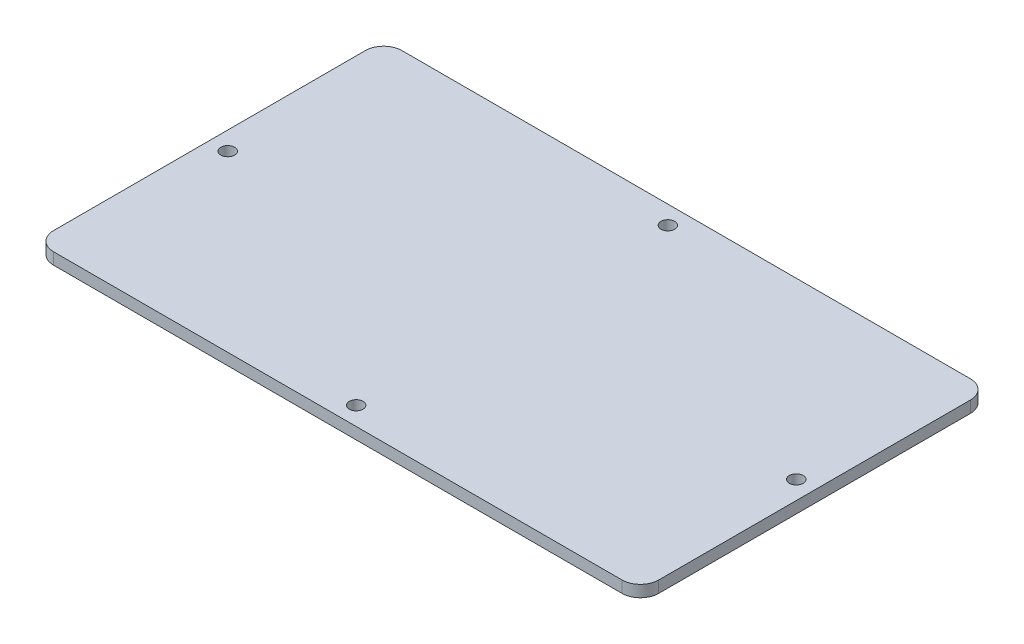
from build123d import *

# Parameters (mm, degrees)
SKETCH1_R           = 1.875
BOSS_EXTRUDE1_DEPTH = 3.175


with BuildPart() as part:
    # Sketch1 → Boss-Extrude1 (new body)
    with BuildSketch(Plane(origin=(0, 0, 0), x_dir=(1, 0, 0), z_dir=(0, 1, 0))):
        with BuildLine():
            Line((-5, 0), (-160, 0))
            ThreePointArc((-160, 0), (-163.535533906, 1.464466094), (-165, 5))
            Line((-165, 5), (-165, 90))
            ThreePointArc((-165, 90), (-163.535533906, 93.535533906), (-160, 95))
            Line((-160, 95), (-5, 95))
            ThreePointArc((-5, 95), (-1.464466094, 93.535533906), (0, 90))
            Line((0, 90), (0, 5))
            ThreePointArc((0, 5), (-1.464466094, 1.464466094), (-5, 0))
        make_face()
        with Locations(Location((-160, 47.5, 0), (0, 0, 270))):
            Circle(SKETCH1_R, mode=Mode.SUBTRACT)
        with Locations(Location((-5, 47.5, 0), (0, 0, 270))):
            Circle(SKETCH1_R, mode=Mode.SUBTRACT)
        with Locations(Location((-82.5, 90, 0), (0, 0, 270))):
            Circle(SKETCH1_R, mode=Mode.SUBTRACT)
        with Locations(Location((-82.5, 5, 0), (0, 0, 270))):
            Circle(SKETCH1_R, mode=Mode.SUBTRACT)
    extrude(amount=BOSS_EXTRUDE1_DEPTH)


solid = part.part
